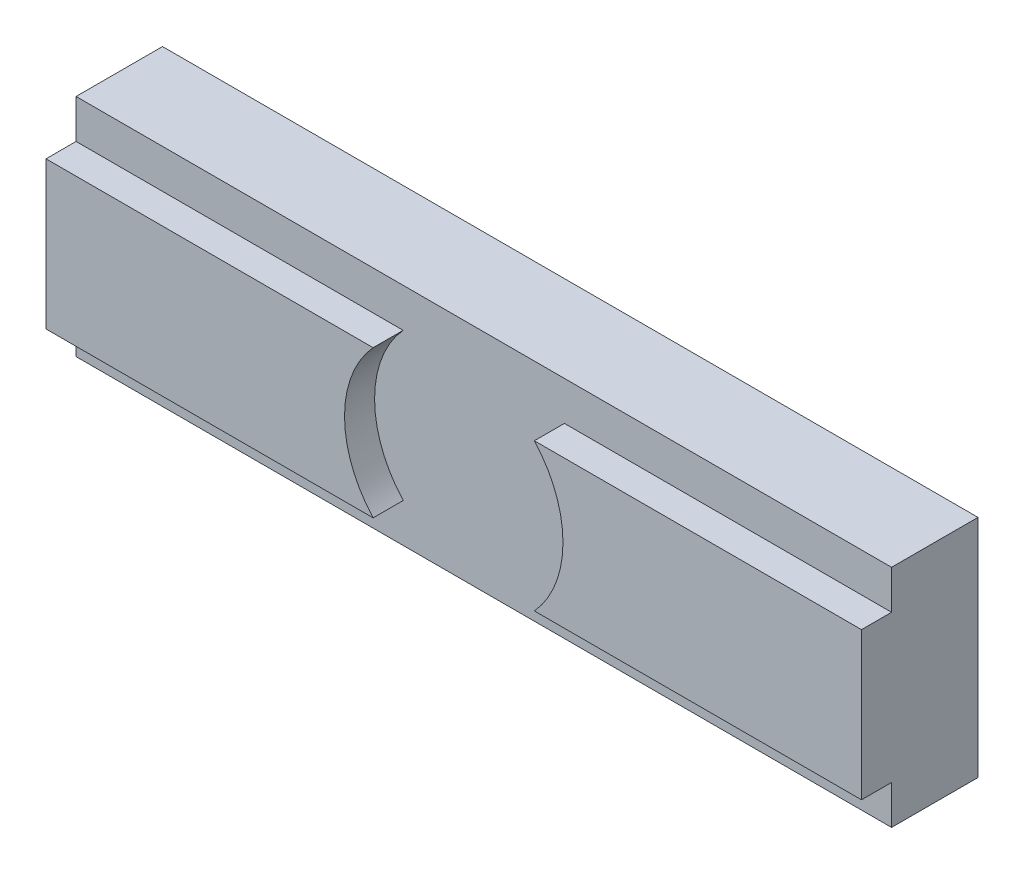
from build123d import *

# Parameters (mm, degrees)
BOSS_EXTRUDE1_DEPTH = 140
SKETCH2_R           = 18.75
CUT_EXTRUDE1_DEPTH  = 5.16


with BuildPart() as part:
    # Sketch1 → Boss-Extrude1 (new body)
    with BuildSketch(Plane(origin=(0, 0, 0), x_dir=(0, 0, -1), z_dir=(1, 0, 0))):
        Polygon((-4.84, 12.650615569), (-10, 12.650615569), (-10, -12.650615569), (-4.84, -12.650615569), (-4.84, -19.34), (10, -19.34), (10, 19.34), (-4.84, 19.34), align=None)
    extrude(amount=BOSS_EXTRUDE1_DEPTH)

    # Sketch2 → Cut-Extrude1 (cut)
    with BuildSketch(Plane.XY.offset(10)):
        with Locations((70, 0)):
            Circle(SKETCH2_R)
    extrude(amount=-CUT_EXTRUDE1_DEPTH, mode=Mode.SUBTRACT)


solid = part.part
